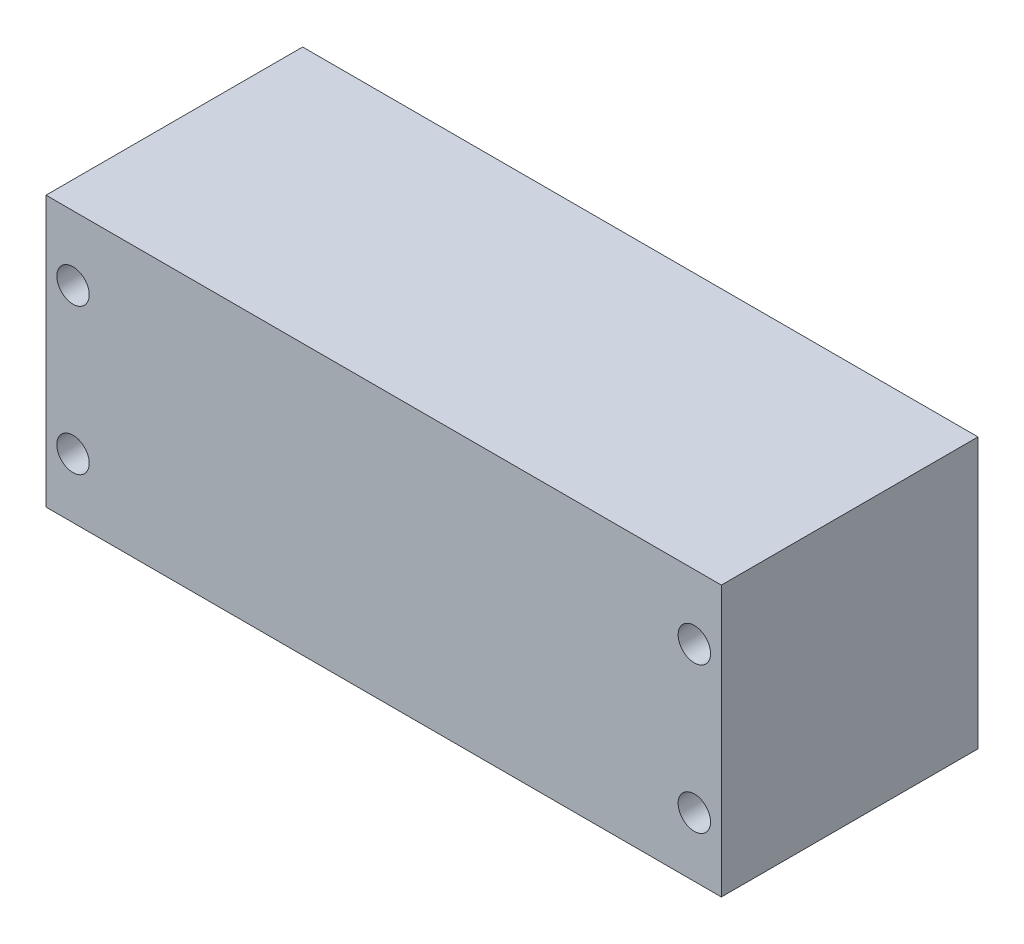
from build123d import *

# Parameters (mm, degrees)
SKETCH1_W           = 100
SKETCH1_H           = 40
BOSS_EXTRUDE1_DEPTH = 38
CUT_EXTRUDE2_START  = -12
SKETCH2_W           = 39.5
SKETCH2_H           = 34
CUT_EXTRUDE2_DEPTH  = 21
CUT_EXTRUDE3_DEPTH  = 9
CUT_EXTRUDE4_REACH  = 81.36
SKETCH4_R           = 2.4


with BuildPart() as part:
    # Sketch1 → Boss-Extrude1 (new body)
    with BuildSketch(Plane.XY):
        with Locations((16.25, 1.5625)):
            Rectangle(SKETCH1_W, SKETCH1_H)
    extrude(amount=BOSS_EXTRUDE1_DEPTH)

    # Sketch2 → Cut-Extrude2 (cut)
    with BuildSketch(Plane(origin=(0, 0, 0), x_dir=(-1, 0, 0), z_dir=(0, 0, -1)).offset(CUT_EXTRUDE2_START)):
        with Locations((-38.5, 1.5625)):
            Rectangle(SKETCH2_W, SKETCH2_H)
        with Locations((6, 1.5625)):
            Rectangle(SKETCH2_W, SKETCH2_H)
    extrude(amount=-CUT_EXTRUDE2_DEPTH, mode=Mode.SUBTRACT)

    # Sketch3 → Cut-Extrude3 (cut)
    with BuildSketch(Plane(origin=(-3.362318072, 0, 0), x_dir=(-1, 0, 0), z_dir=(0, 0, -1))):
        with BuildLine():
            ThreePointArc((-61.593370612, 1.614325749), (-20.676836723, -17.421621422), (21.715969185, -1.949710178))
            ThreePointArc((21.715969185, -1.949710178), (22.204299442, 9.465009595), (10.78957967, 9.953339852))
            ThreePointArc((10.78957967, 9.953339852), (-19.986233449, -1.278769909), (-49.690320582, 12.540715264))
            ThreePointArc((-49.690320582, 12.540715264), (-61.105040355, 13.029045522), (-61.593370612, 1.614325749))
        make_face()
    extrude(amount=-CUT_EXTRUDE3_DEPTH, mode=Mode.SUBTRACT)

    # Sketch4 → Cut-Extrude4 (cut, up to next)
    with BuildSketch(Plane(origin=(0, 0, 0), x_dir=(-1, 0, 0), z_dir=(0, 0, -1)), mode=Mode.PRIVATE) as cut_extrude4_sk1:
        with Locations((-62.25, 11.98479819)):
            Circle(SKETCH4_R)
    cut_extrude4_tool1 = extrude(cut_extrude4_sk1.sketch, amount=-CUT_EXTRUDE4_REACH, mode=Mode.PRIVATE) & part.part
    # Sketch4 → Cut-Extrude4 (cut, up to next)
    with BuildSketch(Plane(origin=(0, 0, 0), x_dir=(-1, 0, 0), z_dir=(0, 0, -1)), mode=Mode.PRIVATE) as cut_extrude4_sk2:
        with Locations((-62.25, -9.616561755)):
            Circle(SKETCH4_R)
    cut_extrude4_tool2 = extrude(cut_extrude4_sk2.sketch, amount=-CUT_EXTRUDE4_REACH, mode=Mode.PRIVATE) & part.part
    # Sketch4 → Cut-Extrude4 (cut, up to next)
    with BuildSketch(Plane(origin=(0, 0, 0), x_dir=(-1, 0, 0), z_dir=(0, 0, -1)), mode=Mode.PRIVATE) as cut_extrude4_sk3:
        with Locations((29.75, 11.98479819)):
            Circle(SKETCH4_R)
    cut_extrude4_tool3 = extrude(cut_extrude4_sk3.sketch, amount=-CUT_EXTRUDE4_REACH, mode=Mode.PRIVATE) & part.part
    # Sketch4 → Cut-Extrude4 (cut, up to next)
    with BuildSketch(Plane(origin=(0, 0, 0), x_dir=(-1, 0, 0), z_dir=(0, 0, -1)), mode=Mode.PRIVATE) as cut_extrude4_sk4:
        with Locations((29.75, -9.616561755)):
            Circle(SKETCH4_R)
    cut_extrude4_tool4 = extrude(cut_extrude4_sk4.sketch, amount=-CUT_EXTRUDE4_REACH, mode=Mode.PRIVATE) & part.part
    add(cut_extrude4_tool1.solids().sort_by_distance((62.25, 11.984798, 0))[0], mode=Mode.SUBTRACT)
    add(cut_extrude4_tool2.solids().sort_by_distance((62.25, -9.616562, 0))[0], mode=Mode.SUBTRACT)
    add(cut_extrude4_tool3.solids().sort_by_distance((-29.75, 11.984798, 0))[0], mode=Mode.SUBTRACT)
    add(cut_extrude4_tool4.solids().sort_by_distance((-29.75, -9.616562, 0))[0], mode=Mode.SUBTRACT)


solid = part.part
